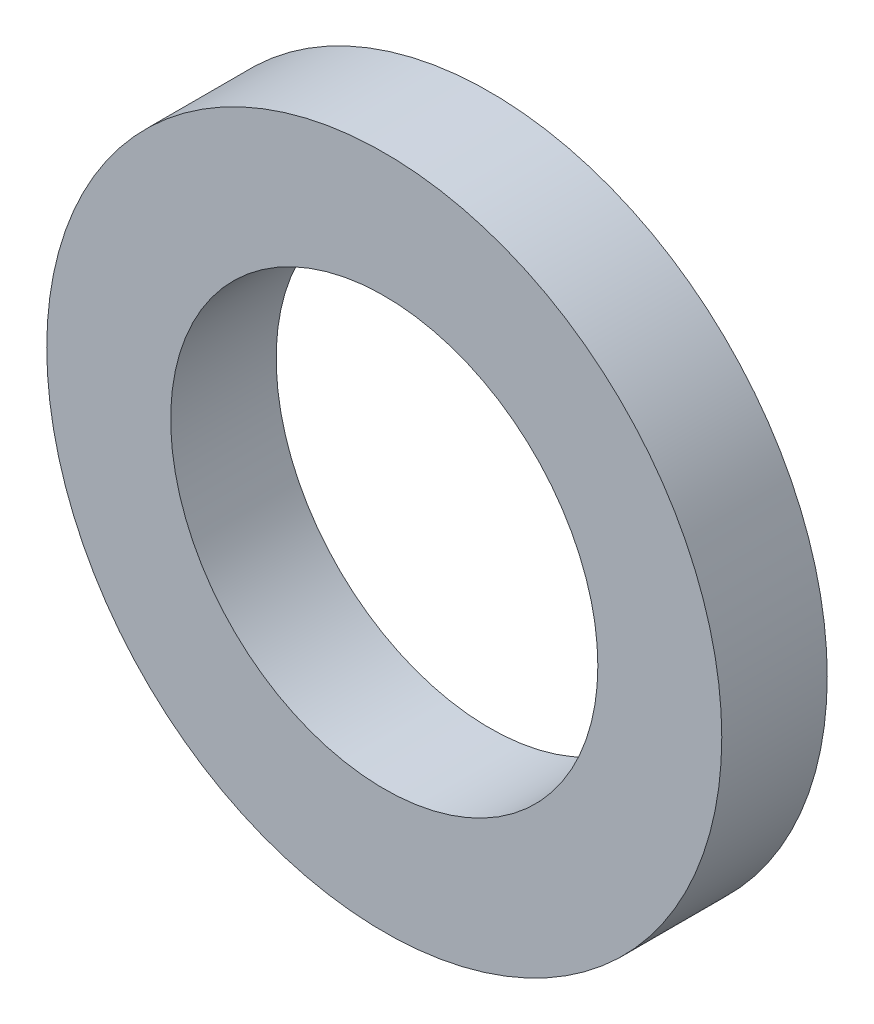
from build123d import *

# Parameters (mm, degrees)
ESQUISSE2_R        = 6.4
ESQUISSE2_R_2      = 4.05
BOSS_EXTRU_1_DEPTH = 2


with BuildPart() as part:
    # Esquisse2 → Boss.-Extru.1 (new body)
    with BuildSketch(Plane.XY):
        Circle(ESQUISSE2_R)
        Circle(ESQUISSE2_R_2, mode=Mode.SUBTRACT)
    extrude(amount=BOSS_EXTRU_1_DEPTH)


solid = part.part
